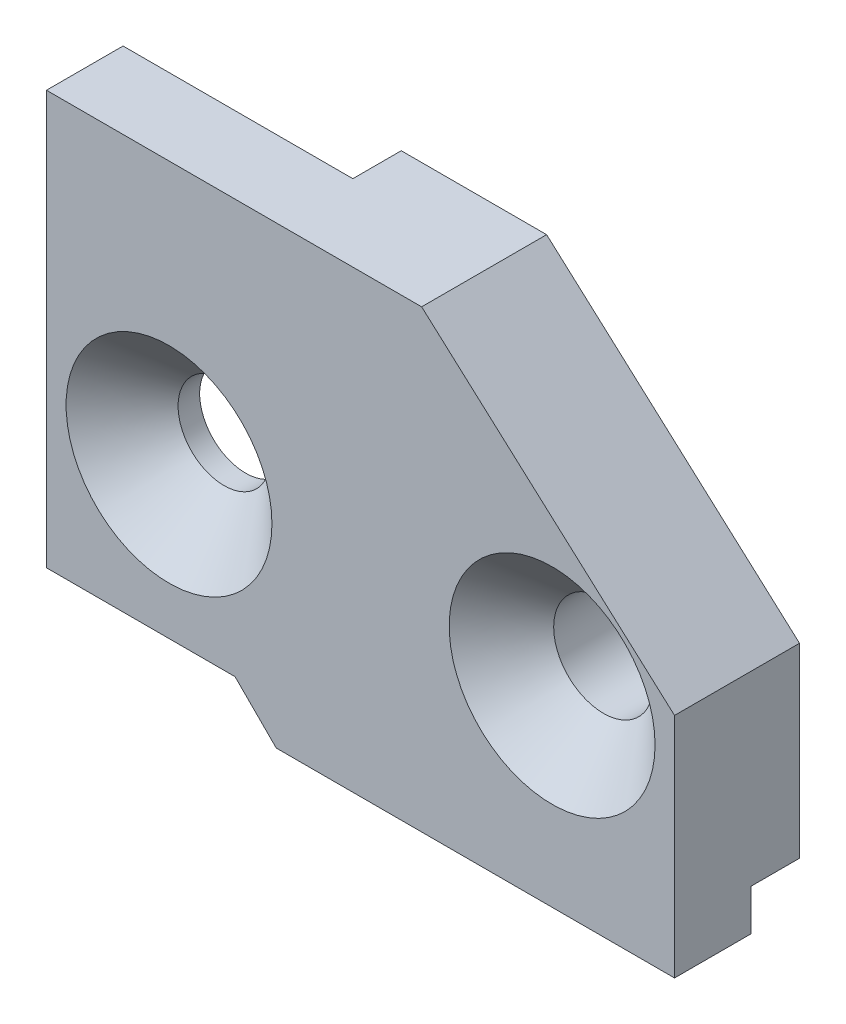
from build123d import *
from build123d.topology import SkipClean

# Parameters (mm, degrees)
CROQUIS1_R                      = 1.5
CROQUIS1_R_2                    = 1.625
SALIENTE_EXTRUIR1_DEPTH         = 2.5
SALIENTE_EXTRUIR2_START         = 1.58
CROQUIS2_R                      = 1.625
SALIENTE_EXTRUIR2_DEPTH         = 1.58
CROQUIS3_R                      = 3.35997123
CORTAR_EXTRUIR1_DEPTH           = 1.8
CORTAR_EXTRUIR1_DRAFT           = -46
CORTAR_EXTRUIR1_PROFILE_2_DEPTH = 1.8
CORTAR_EXTRUIR1_PROFILE_2_DRAFT = -46


with BuildPart() as part:
    # Croquis1 → Saliente-Extruir1 (new body)
    with BuildSketch(Plane.XY):
        Polygon((-90.077371, -80.148646), (-88.732371, -81.493646), (-75.732371, -81.493646), (-75.732371, -74.071146), (-83.98707047, -66.648646), (-88.732371, -66.648646), (-96.232371, -66.648646), (-96.232371, -80.148646), align=None)
        with Locations((-92.232371, -75.223646)):
            Circle(CROQUIS1_R, mode=Mode.SUBTRACT)
        with Locations((-79.72767153, -75.223646)):
            Circle(CROQUIS1_R_2, mode=Mode.SUBTRACT)
    extrude(amount=SALIENTE_EXTRUIR1_DEPTH)

    # Croquis2 → Saliente-Extruir2 (add)
    with SkipClean():  # the faces are left unmerged after this step: merging them gives an invalid solid
        with BuildSketch(Plane(origin=(0, 0, 0), x_dir=(-1, 0, 0), z_dir=(0, 0, -1)).offset(SALIENTE_EXTRUIR2_START)):
            Polygon((75.732371, -74.071146), (75.732371, -80.148646), (88.732371, -80.148646), (88.732371, -66.648646), (83.98707047, -66.648646), align=None)
            with Locations((79.72767153, -75.223646)):
                Circle(CROQUIS2_R, mode=Mode.SUBTRACT)
        extrude(amount=-SALIENTE_EXTRUIR2_DEPTH)


with BuildPart() as cortar_extruir1_tool:
    # Croquis3 → Cortar-Extruir1 (with draft: the straight prism first)
    with BuildSketch(Plane.XY.offset(2.5)):
        with Locations((-92.232371, -75.223646)):
            Circle(CROQUIS3_R)
    extrude(amount=-CORTAR_EXTRUIR1_DEPTH)
    # Cortar-Extruir1: the draft: its side faces are tilted about the plane it starts from
    cortar_extruir1_sides = [cortar_extruir1_tool.faces().sort_by_distance(p)[0] for p in [
        (-95.59234223, -75.223646, 1.6),
    ]]
    draft(cortar_extruir1_sides, Plane.XY.offset(2.5), CORTAR_EXTRUIR1_DRAFT)


with BuildPart() as part_1:
    add(part.part)

    # Cortar-Extruir1: cut by cortar_extruir1_tool
    add(cortar_extruir1_tool.part, mode=Mode.SUBTRACT)


with BuildPart() as cortar_extruir1_profile_2_tool:
    # Croquis3 → Cortar-Extruir1 profile 2 (with draft: the straight prism first)
    with BuildSketch(Plane.XY.offset(2.5)):
        with Locations((-79.72767153, -75.223646)):
            Circle(CROQUIS3_R)
    extrude(amount=-CORTAR_EXTRUIR1_PROFILE_2_DEPTH)
    # Cortar-Extruir1 profile 2: the draft: its side faces are tilted about the plane it starts from
    cortar_extruir1_profile_2_sides = [cortar_extruir1_profile_2_tool.faces().sort_by_distance(p)[0] for p in [
        (-83.08764276, -75.223646, 1.6),
    ]]
    draft(cortar_extruir1_profile_2_sides, Plane.XY.offset(2.5), CORTAR_EXTRUIR1_PROFILE_2_DRAFT)


with BuildPart() as part_2:
    add(part_1.part)

    # Cortar-Extruir1 profile 2: cut by cortar_extruir1_profile_2_tool
    add(cortar_extruir1_profile_2_tool.part, mode=Mode.SUBTRACT)


solid = part_2.part
